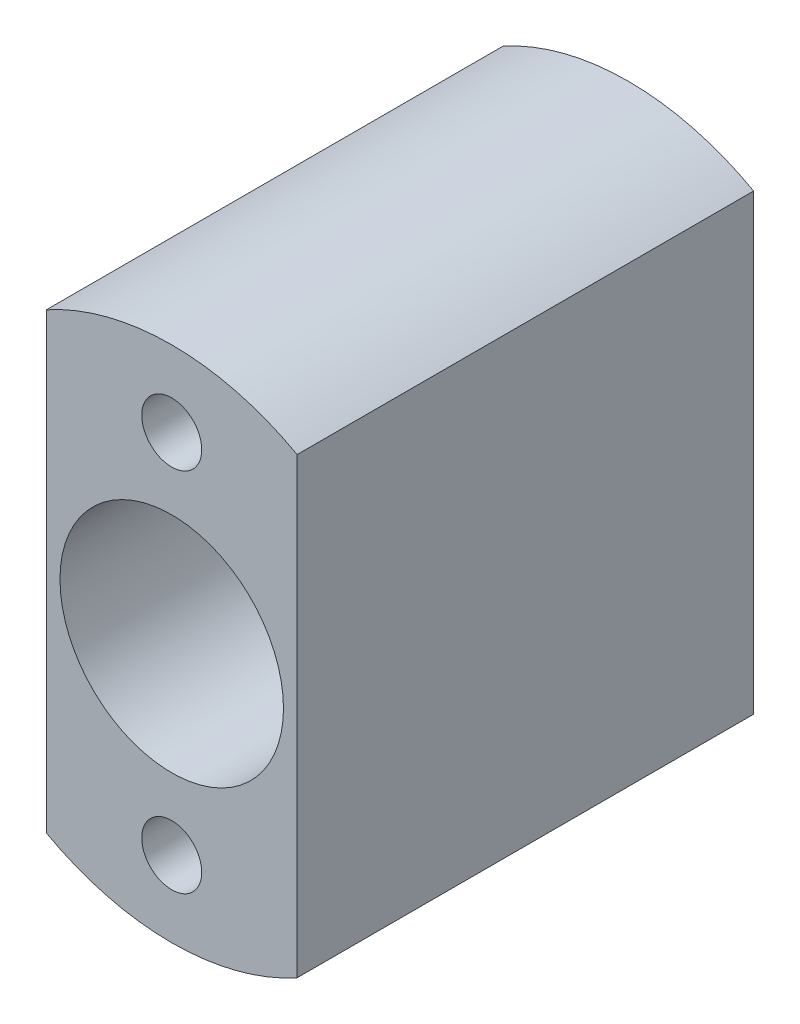
from build123d import *

# Parameters (mm, degrees)
EXTRUDE1_DEPTH     = 16.75
SKETCH3_R          = 1.1
CUT_EXTRUDE1_DEPTH = 20.798295381
SKETCH5_R          = 4.1
CUT_EXTRUDE2_DEPTH = 24


with BuildPart() as part:
    # Sketch1 → Extrude1 (new body)
    with BuildSketch(Plane.XY):
        with BuildLine():
            Line((-4.6, -8.312039461), (-4.6, 8.312039461))
            ThreePointArc((-4.6, 8.312039461), (0, 9.5), (4.6, 8.312039461))
            Line((4.6, 8.312039461), (4.6, -8.312039461))
            ThreePointArc((4.6, -8.312039461), (0, -9.5), (-4.6, -8.312039461))
        make_face()
    extrude(amount=EXTRUDE1_DEPTH)

    # Sketch3 → Cut-Extrude1 (cut, through all)
    with BuildSketch(Plane.XY.offset(16.75)):
        with Locations((0, 6.715)):
            Circle(SKETCH3_R)
        with Locations(Location((0, -6.715, 0), (0, 0, 180))):
            Circle(SKETCH3_R)
    extrude(amount=-CUT_EXTRUDE1_DEPTH, mode=Mode.SUBTRACT)

    # Sketch5 → Cut-Extrude2 (cut)
    with BuildSketch(Plane(origin=(0, 0, 0), x_dir=(-1, 0, 0), z_dir=(0, 0, -1))):
        Circle(SKETCH5_R)
    extrude(amount=-CUT_EXTRUDE2_DEPTH, mode=Mode.SUBTRACT)


solid = part.part
